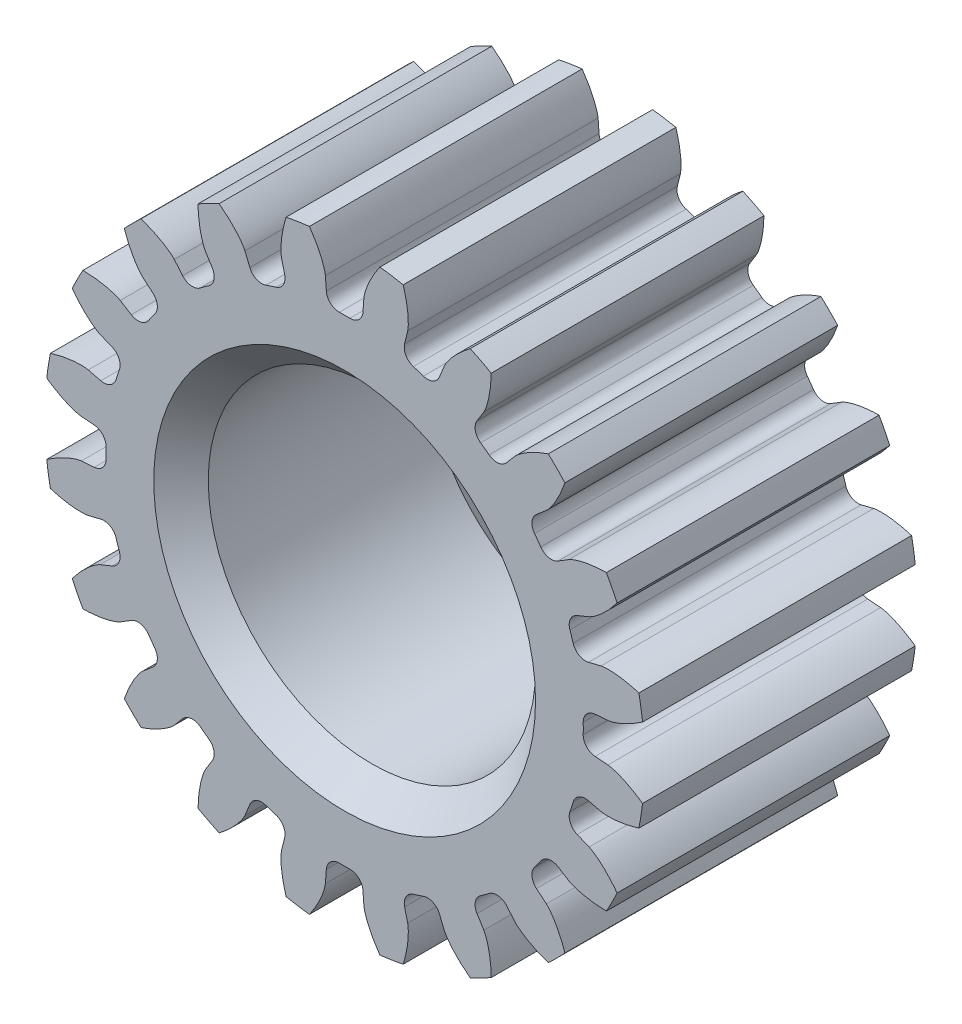
from build123d import *

# Parameters (mm, degrees)
SKETCH1_R              = 6.985
BODYBLANK_DEPTH        = 6.35
TOOTHCUTMASTER_DEPTH   = 12.743208676
TOOTHCUTSPATTERN_COUNT = 20
SKETCH2_R              = 3.81
CUT_EXTRUDE1_DEPTH     = 12.685755771
CHAMFER1_SIZE          = 0.635


with BuildPart() as part:
    # Sketch1 → BodyBlank (new body)
    with BuildSketch(Plane.XY):
        Circle(SKETCH1_R)
    extrude(amount=BODYBLANK_DEPTH)

    # EqDrivenInvoluteCurves → ToothCutMaster (cut, through all)
    with BuildSketch(Plane.XY.offset(6.35)):
        with BuildLine():
            Line((5.830765324, 0.426374108), (6.131366397, 0.44835553))
            add(Edge.make_bspline(
                [(6.131366397, 0.44835553), (6.132684058, 0.448467013), (6.136376053, 0.448826282), (6.143340854, 0.449689456), (6.15468169, 0.451359025), (6.16909431, 0.453869926), (6.187675828, 0.457555421), (6.209500557, 0.462462634), (6.233412665, 0.468447553), (6.259344216, 0.475597152), (6.285136313, 0.483293746), (6.310788164, 0.491495699), (6.336269216, 0.500138546), (6.367045129, 0.511165367), (6.403820617, 0.525162141), (6.446607794, 0.54264861), (6.494892685, 0.563808514), (6.543829151, 0.586790377), (6.591752226, 0.610567229), (6.639892577, 0.635923739), (6.686271914, 0.661401833), (6.734142719, 0.689226715), (6.778176638, 0.715602927), (6.827159192, 0.746655088), (6.866587129, 0.772153131), (6.907012609, 0.799741002), (6.92664272, 0.813352251), (6.936655674, 0.820385918)],
                knots=[0, 0, 0, 0, 0, 0.005376749, 0.015083688, 0.02853182, 0.04661014, 0.064854849, 0.092110526, 0.119476176, 0.146842496, 0.174208854, 0.201574956, 0.228941013, 0.256307345, 0.307035032, 0.361767352, 0.416499661, 0.471231937, 0.525964282, 0.580696616, 0.635428982, 0.690161387, 0.744893688, 0.799626082, 0.854358407, 0.909090914, 0.909090914, 0.909090914, 0.909090914, 0.909090914], degree=4))
            ThreePointArc((6.936655674, 0.820385918), (6.985, 0), (6.936655674, -0.820385918))
            add(Edge.make_bspline(
                [(6.131366397, -0.44835553), (6.132684058, -0.448467013), (6.136376053, -0.448826282), (6.143340854, -0.449689456), (6.15468169, -0.451359025), (6.16909431, -0.453869926), (6.187675828, -0.457555421), (6.209500557, -0.462462634), (6.233412665, -0.468447553), (6.259344216, -0.475597152), (6.285136313, -0.483293746), (6.310788164, -0.491495699), (6.336269216, -0.500138546), (6.367045129, -0.511165367), (6.403820617, -0.525162141), (6.446607794, -0.54264861), (6.494892685, -0.563808514), (6.543829151, -0.586790377), (6.591752226, -0.610567229), (6.639892577, -0.635923739), (6.686271914, -0.661401833), (6.734142719, -0.689226715), (6.778176638, -0.715602927), (6.827159192, -0.746655088), (6.866587129, -0.772153131), (6.907012609, -0.799741002), (6.92664272, -0.813352251), (6.936655674, -0.820385918)],
                knots=[0, 0, 0, 0, 0, 0.005376749, 0.015083688, 0.02853182, 0.04661014, 0.064854849, 0.092110526, 0.119476176, 0.146842496, 0.174208854, 0.201574956, 0.228941013, 0.256307345, 0.307035032, 0.361767352, 0.416499661, 0.471231937, 0.525964282, 0.580696616, 0.635428982, 0.690161387, 0.744893688, 0.799626082, 0.854358407, 0.909090914, 0.909090914, 0.909090914, 0.909090914, 0.909090914], degree=4))
            Line((6.131366397, -0.44835553), (5.830765324, -0.426374108))
            ThreePointArc((5.830765324, -0.426374108), (5.632230227, -0.32974079), (5.554890049, -0.122925222))
            ThreePointArc((5.554890049, -0.122925222), (5.55625, 0), (5.554890049, 0.122925222))
            ThreePointArc((5.554890049, 0.122925222), (5.632230227, 0.32974079), (5.830765324, 0.426374108))
        make_face()
    toothcutmaster = extrude(amount=-TOOTHCUTMASTER_DEPTH, mode=Mode.SUBTRACT)

    # ToothCutsPattern: ToothCutMaster ×20 about axis
    toothcutspattern_axis = Axis((0, 0, 6.35), (0, 0, -1))
    for i in range(1, TOOTHCUTSPATTERN_COUNT):
        add(toothcutmaster.rotate(toothcutspattern_axis, i * 360 / TOOTHCUTSPATTERN_COUNT), mode=Mode.SUBTRACT)

    # Sketch2 → Cut-Extrude1 (cut, through all)
    with BuildSketch(Plane.XY.offset(6.35)):
        Circle(SKETCH2_R)
    extrude(amount=-CUT_EXTRUDE1_DEPTH, mode=Mode.SUBTRACT)

    # Chamfer1
    chamfer1_edges = [part.edges().sort_by_distance(p)[0] for p in [
        (-3.81, 0, 0),
        (-3.81, 0, 6.35),
    ]]
    chamfer(chamfer1_edges, length=CHAMFER1_SIZE)


solid = part.part
